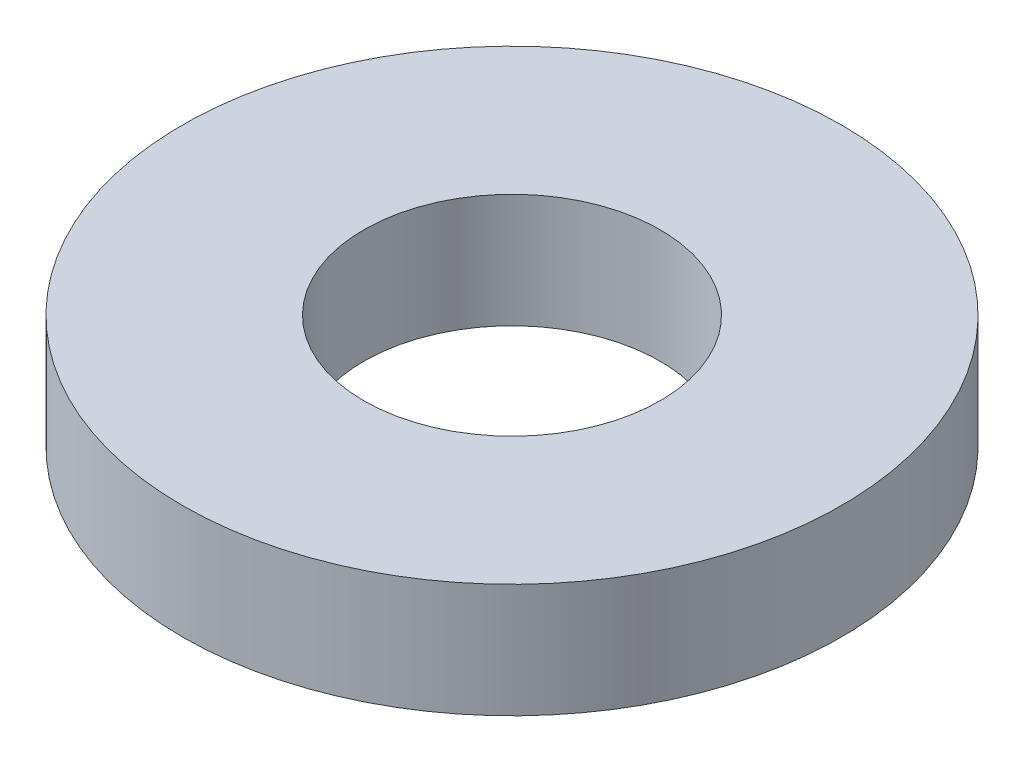
from build123d import *

# Parameters (mm, degrees)
SKETCH1_R           = 7.9375
SKETCH1_R_2         = 3.5687
BOSS_EXTRUDE1_DEPTH = 2.7432


with BuildPart() as part:
    # Sketch1 → Boss-Extrude1 (new body)
    with BuildSketch(Plane(origin=(0, 0, 0), x_dir=(1, 0, 0), z_dir=(0, 1, 0))):
        with Locations(Location((0, 0, 0), (0, 0, 270))):
            Circle(SKETCH1_R)
        with Locations(Location((0, 0, 0), (0, 0, 270))):
            Circle(SKETCH1_R_2, mode=Mode.SUBTRACT)
    extrude(amount=BOSS_EXTRUDE1_DEPTH)


solid = part.part
